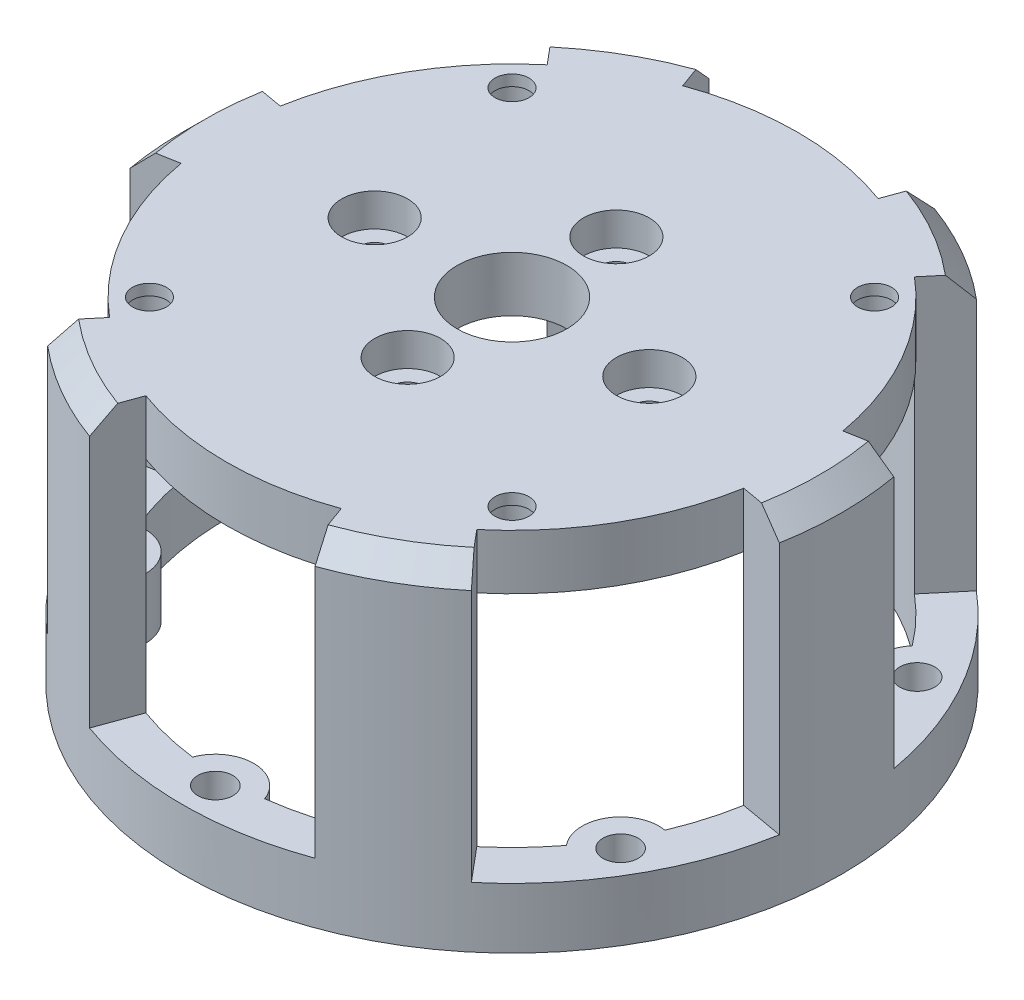
from build123d import *

# Parameters (mm, degrees)
SKETCH1_R           = 30
BOSS_EXTRUDE1_DEPTH = 30.5
SKETCH4_R           = 5
CUT_EXTRUDE2_DEPTH  = 30.5
CUT_EXTRUDE3_DEPTH  = 25
CIRPATTERN1_COUNT   = 6
CUT_EXTRUDE4_START  = -25.5
SKETCH13_R          = 26
CUT_EXTRUDE4_DEPTH  = 25.5
CHAMFER1_SIZE       = 2
BOSS_EXTRUDE2_DEPTH = 5.5
SKETCH17_R          = 1.6
CUT_EXTRUDE5_DEPTH  = 5.5
CIRPATTERN2_COUNT   = 6
SKETCH19_R          = 1.55
CUT_EXTRUDE6_DEPTH  = 5
SKETCH20_R          = 2
CUT_EXTRUDE7_DEPTH  = 4
CIRPATTERN3_COUNT   = 4
SKETCH21_R          = 1.5
CUT_EXTRUDE8_DEPTH  = 5
SKETCH22_R          = 1.5
CUT_EXTRUDE9_DEPTH  = 5
SKETCH23_R          = 3
CUT_EXTRUDE10_DEPTH = 3
CIRPATTERN5_COUNT   = 2


with BuildPart() as part:
    # Sketch1 → Boss-Extrude1 (new body)
    with BuildSketch(Plane(origin=(0, 0, 0), x_dir=(1, 0, 0), z_dir=(0, 1, 0))):
        with Locations(Location((0, 0, 0), (0, 0, 90))):
            Circle(SKETCH1_R)
    extrude(amount=BOSS_EXTRUDE1_DEPTH)

    # Sketch4 → Cut-Extrude2 (cut)
    with BuildSketch(Plane(origin=(0, 30.5, 0), x_dir=(1, 0, 0), z_dir=(0, 1, 0))):
        with Locations(Location((0, 0, 0), (0, 0, 270))):
            Circle(SKETCH4_R)
    extrude(amount=-CUT_EXTRUDE2_DEPTH, mode=Mode.SUBTRACT)

    # Sketch5 → Cut-Extrude3 (cut)
    with BuildSketch(Plane(origin=(0, 30.5, 0), x_dir=(1, 0, 0), z_dir=(0, 1, 0))):
        with BuildLine():
            Line((-12.825755375, 35.238473279), (-8.892523726, 24.43200814))
            ThreePointArc((-8.892523726, 24.43200814), (0, 26), (8.892523726, 24.43200814))
            Line((8.892523726, 24.43200814), (12.825755375, 35.238473279))
            ThreePointArc((12.825755375, 35.238473279), (0, 37.5), (-12.825755375, 35.238473279))
        make_face()
    cut_extrude3 = extrude(amount=-CUT_EXTRUDE3_DEPTH, mode=Mode.SUBTRACT)

    # CirPattern1: Cut-Extrude3 ×6 about axis
    cirpattern1_axis = Axis((0, 0, 0), (0, 1, 0))
    for i in range(1, CIRPATTERN1_COUNT):
        add(cut_extrude3.rotate(cirpattern1_axis, i * 360 / CIRPATTERN1_COUNT), mode=Mode.SUBTRACT)

    # Sketch13 → Cut-Extrude4 (cut)
    with BuildSketch(Plane.XZ.offset(CUT_EXTRUDE4_START)):
        with Locations(Location((0, 0, 0), (0, 0, 270))):
            Circle(SKETCH13_R)
    extrude(amount=CUT_EXTRUDE4_DEPTH, mode=Mode.SUBTRACT)

    # Chamfer1
    chamfer1_edges = [part.edges().sort_by_distance(p)[0] for p in [
        (-15, 30.5, -25.980762114),
        (-30, 30.5, 0),
        (-15, 30.5, 25.980762114),
        (15, 30.5, 25.980762114),
        (30, 30.5, 0),
        (15, 30.5, -25.980762114),
    ]]
    chamfer(chamfer1_edges, length=CHAMFER1_SIZE)

    # Sketch15 → Boss-Extrude2 (add)
    with BuildSketch(Plane.XZ):
        with BuildLine():
            Line((-3.391631546, 27.864196424), (3.391631546, 27.864196424))
            ThreePointArc((3.391631546, 27.864196424), (0, 23.5), (-3.391631546, 27.864196424))
        make_face()
    boss_extrude2 = extrude(amount=-BOSS_EXTRUDE2_DEPTH)

    # Sketch17 → Cut-Extrude5 (cut)
    with BuildSketch(Plane.XZ):
        with Locations(Location((0, 27, 0), (0, 0, 270))):
            Circle(SKETCH17_R)
    cut_extrude5 = extrude(amount=-CUT_EXTRUDE5_DEPTH, mode=Mode.SUBTRACT)

    # CirPattern2: Boss-Extrude2, Cut-Extrude5 ×6 about axis
    cirpattern2_axis = Axis((0, 0, 0), (0, 1, 0))
    add([boss_extrude2.rotate(cirpattern2_axis, i * 360 / CIRPATTERN2_COUNT) for i in range(1, CIRPATTERN2_COUNT)])
    add([cut_extrude5.rotate(cirpattern2_axis, i * 360 / CIRPATTERN2_COUNT) for i in range(1, CIRPATTERN2_COUNT)], mode=Mode.SUBTRACT)

    # Sketch19 → Cut-Extrude6 (cut)
    with BuildSketch(Plane(origin=(0, 30.5, 0), x_dir=(1, 0, 0), z_dir=(0, 1, 0))):
        with Locations(Location((-16.5, 16.5, 0), (0, 0, 270))):
            Circle(SKETCH19_R)
    cut_extrude6 = extrude(amount=-CUT_EXTRUDE6_DEPTH, mode=Mode.SUBTRACT)

    # Sketch20 → Cut-Extrude7 (cut)
    with BuildSketch(Plane.XZ.offset(-25.5)):
        with Locations(Location((-16.5, -16.5, 0), (0, 0, 270))):
            Circle(SKETCH20_R)
    cut_extrude7 = extrude(amount=-CUT_EXTRUDE7_DEPTH, mode=Mode.SUBTRACT)

    # CirPattern3: Cut-Extrude6, Cut-Extrude7 ×4 about axis
    cirpattern3_axis = Axis((0, 0, 0), (0, 1, 0))
    add([cut_extrude6.rotate(cirpattern3_axis, i * 360 / CIRPATTERN3_COUNT) for i in range(1, CIRPATTERN3_COUNT)], mode=Mode.SUBTRACT)
    add([cut_extrude7.rotate(cirpattern3_axis, i * 360 / CIRPATTERN3_COUNT) for i in range(1, CIRPATTERN3_COUNT)], mode=Mode.SUBTRACT)

    # Sketch21 → Cut-Extrude8 (cut)
    with BuildSketch(Plane(origin=(0, 30.5, 0), x_dir=(1, 0, 0), z_dir=(0, 1, 0))):
        with Locations(Location((0, 9.5, 0), (0, 0, 270))):
            Circle(SKETCH21_R)
    cut_extrude8 = extrude(amount=-CUT_EXTRUDE8_DEPTH, mode=Mode.SUBTRACT)

    # Sketch22 → Cut-Extrude9 (cut)
    with BuildSketch(Plane(origin=(0, 30.5, 0), x_dir=(1, 0, 0), z_dir=(0, 1, 0))):
        with Locations(Location((-12.5, 0, 0), (0, 0, 270))):
            Circle(SKETCH22_R)
    cut_extrude9 = extrude(amount=-CUT_EXTRUDE9_DEPTH, mode=Mode.SUBTRACT)

    # Sketch23 → Cut-Extrude10 (cut)
    with BuildSketch(Plane(origin=(0, 30.5, 0), x_dir=(1, 0, 0), z_dir=(0, 1, 0))):
        with Locations(Location((0, 9.5, 0), (0, 0, 270))):
            Circle(SKETCH23_R)
        with Locations(Location((-12.5, 0, 0), (0, 0, 270))):
            Circle(SKETCH23_R)
    cut_extrude10 = extrude(amount=-CUT_EXTRUDE10_DEPTH, mode=Mode.SUBTRACT)

    # CirPattern5: Cut-Extrude8, Cut-Extrude9, Cut-Extrude10 ×2 about axis
    cirpattern5_axis = Axis((0, 0, 0), (0, 1, 0))
    add([cut_extrude8.rotate(cirpattern5_axis, i * 360 / CIRPATTERN5_COUNT) for i in range(1, CIRPATTERN5_COUNT)], mode=Mode.SUBTRACT)
    add([cut_extrude9.rotate(cirpattern5_axis, i * 360 / CIRPATTERN5_COUNT) for i in range(1, CIRPATTERN5_COUNT)], mode=Mode.SUBTRACT)
    add([cut_extrude10.rotate(cirpattern5_axis, i * 360 / CIRPATTERN5_COUNT) for i in range(1, CIRPATTERN5_COUNT)], mode=Mode.SUBTRACT)


solid = part.part
